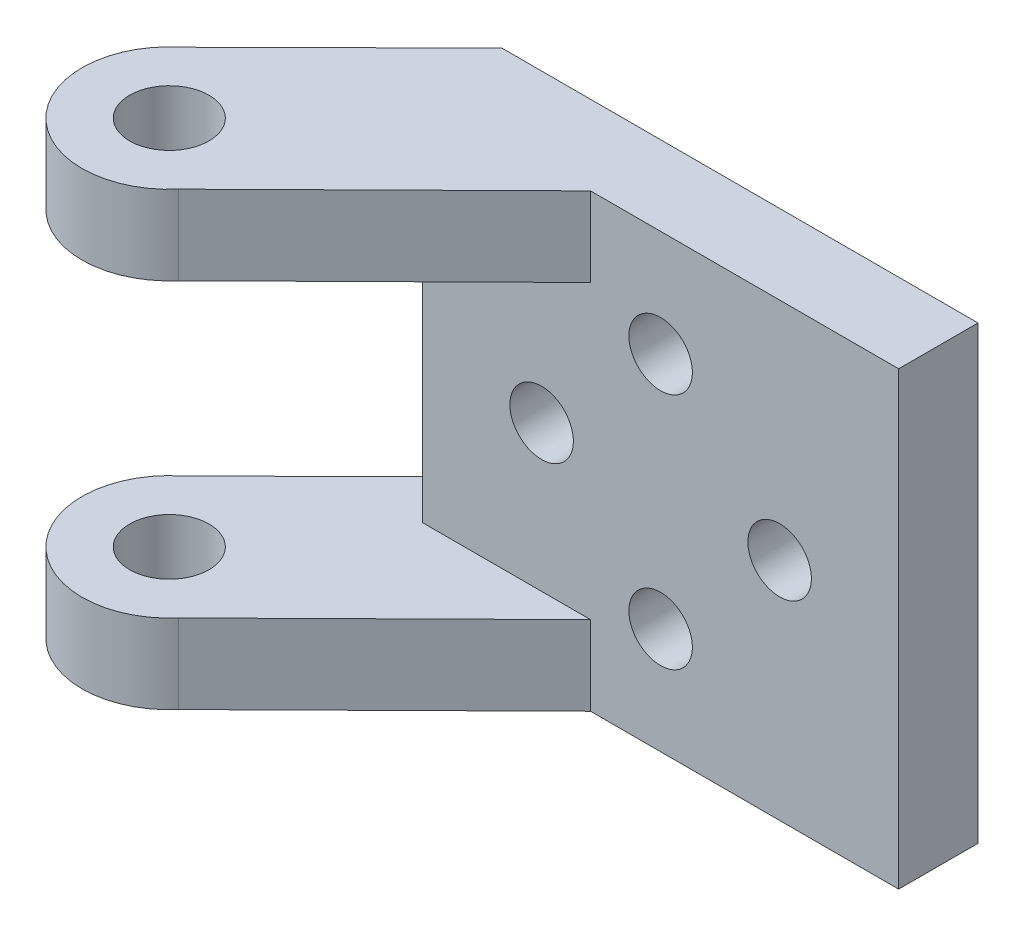
from build123d import *

# Parameters (mm, degrees)
SKETCH1_R           = 2.5
BOSS_EXTRUDE1_DEPTH = 5
SKETCH2_R           = 2
BOSS_EXTRUDE2_DEPTH = 5
CUT_EXTRUDE1_DEPTH  = 42.079586535
BOSS_EXTRUDE3_START = -5
SKETCH3_R           = 2.5
BOSS_EXTRUDE3_DEPTH = 5


with BuildPart() as part:
    # Sketch1 → Boss-Extrude1 (new body)
    with BuildSketch(Plane(origin=(0, 0, 0), x_dir=(1, 0, 0), z_dir=(0, 1, 0))):
        with BuildLine():
            Line((20.049610011, 15.055516278), (-9.950389989, 15.055516278))
            Line((-9.950389989, 15.055516278), (-20.072425289, 5.030348084))
            ThreePointArc((-20.072425289, 5.030348084), (-20.555517893, -3.078179001), (-12.436571265, -2.824613195))
            Line((-12.436571265, -2.824613195), (0.632983681, 10.055516278))
            Line((0.632983681, 10.055516278), (20.049610011, 10.055516278))
            Line((20.049610011, 10.055516278), (20.049610011, 15.055516278))
        make_face()
        with Locations((-16.611816522, 0.755516278)):
            Circle(SKETCH1_R, mode=Mode.SUBTRACT)
    extrude(amount=BOSS_EXTRUDE1_DEPTH)

    # Sketch2 → Boss-Extrude2 (add)
    with BuildSketch(Plane(origin=(0, 0, -15.055516278), x_dir=(-1, 0, 0), z_dir=(0, 0, -1))):
        with BuildLine():
            Line((9.950389989, 5), (9.950389989, 23.4))
            Line((9.950389989, 23.4), (9.950389989, 28.4))
            Line((9.950389989, 28.4), (-20.049610011, 28.4))
            Line((-20.049610011, 28.4), (-20.049610011, 5))
            Line((-20.049610011, 5), (-6.103175386, 5))
            ThreePointArc((-6.103175386, 5), (-6.022458727, 8.447445385), (-3.049610011, 6.7))
            ThreePointArc((-3.049610011, 6.7), (-3.302164625, 5.727151284), (-3.996044635, 5))
            Line((-3.996044635, 5), (9.950389989, 5))
        make_face()
        with Locations((-12.549610011, 14.2)):
            Circle(SKETCH2_R, mode=Mode.SUBTRACT)
        with Locations((-5.049610011, 21.7)):
            Circle(SKETCH2_R, mode=Mode.SUBTRACT)
        with Locations((2.450389989, 14.2)):
            Circle(SKETCH2_R, mode=Mode.SUBTRACT)
    extrude(amount=-BOSS_EXTRUDE2_DEPTH)

    # Sketch2<3> → Cut-Extrude1 (cut, through all)
    with BuildSketch(Plane(origin=(0, 0, -15.055516278), x_dir=(-1, 0, 0), z_dir=(0, 0, -1))):
        with BuildLine():
            ThreePointArc((-6.103175386, 5), (-5.049610011, 4.7), (-3.996044635, 5))
            Line((-3.996044635, 5), (-6.103175386, 5))
        make_face()
    extrude(amount=-CUT_EXTRUDE1_DEPTH, mode=Mode.SUBTRACT)

    # Sketch3 → Boss-Extrude3 (add)
    with BuildSketch(Plane(origin=(0, 28.4, 0), x_dir=(1, 0, 0), z_dir=(0, 1, 0)).offset(BOSS_EXTRUDE3_START)):
        with BuildLine():
            Line((-9.950389989, 10.055516278), (-9.950389989, 15.055516278))
            Line((-9.950389989, 15.055516278), (-20.072425289, 5.030348084))
            ThreePointArc((-20.072425289, 5.030348084), (-20.555517893, -3.078179001), (-12.436571265, -2.824613195))
            Line((-12.436571265, -2.824613195), (0.632983681, 10.055516278))
            Line((0.632983681, 10.055516278), (-9.950389989, 10.055516278))
        make_face()
        with Locations((-16.611816522, 0.755516278)):
            Circle(SKETCH3_R, mode=Mode.SUBTRACT)
    extrude(amount=BOSS_EXTRUDE3_DEPTH)


solid = part.part
